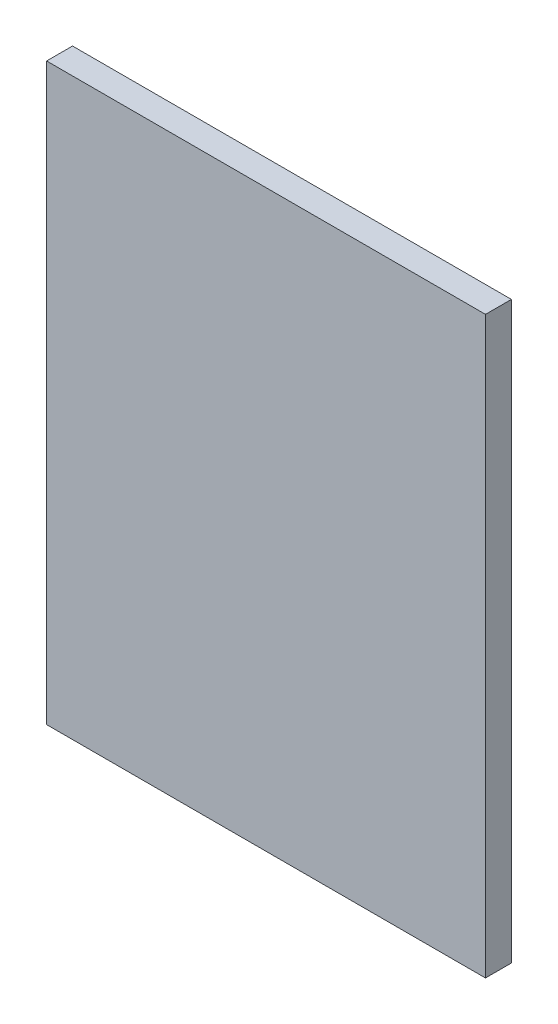
from build123d import *

# Parameters (mm, degrees)
ESBO_O1_W                = 420
ESBO_O1_H                = 550
RESSALTO_EXTRUS_O1_DEPTH = 24.8


with BuildPart() as part:
    # Esboço1 → Ressalto-extrusão1 (new body)
    with BuildSketch(Plane.XY):
        with Locations((210, 275)):
            Rectangle(ESBO_O1_W, ESBO_O1_H)
    extrude(amount=RESSALTO_EXTRUS_O1_DEPTH)


solid = part.part
